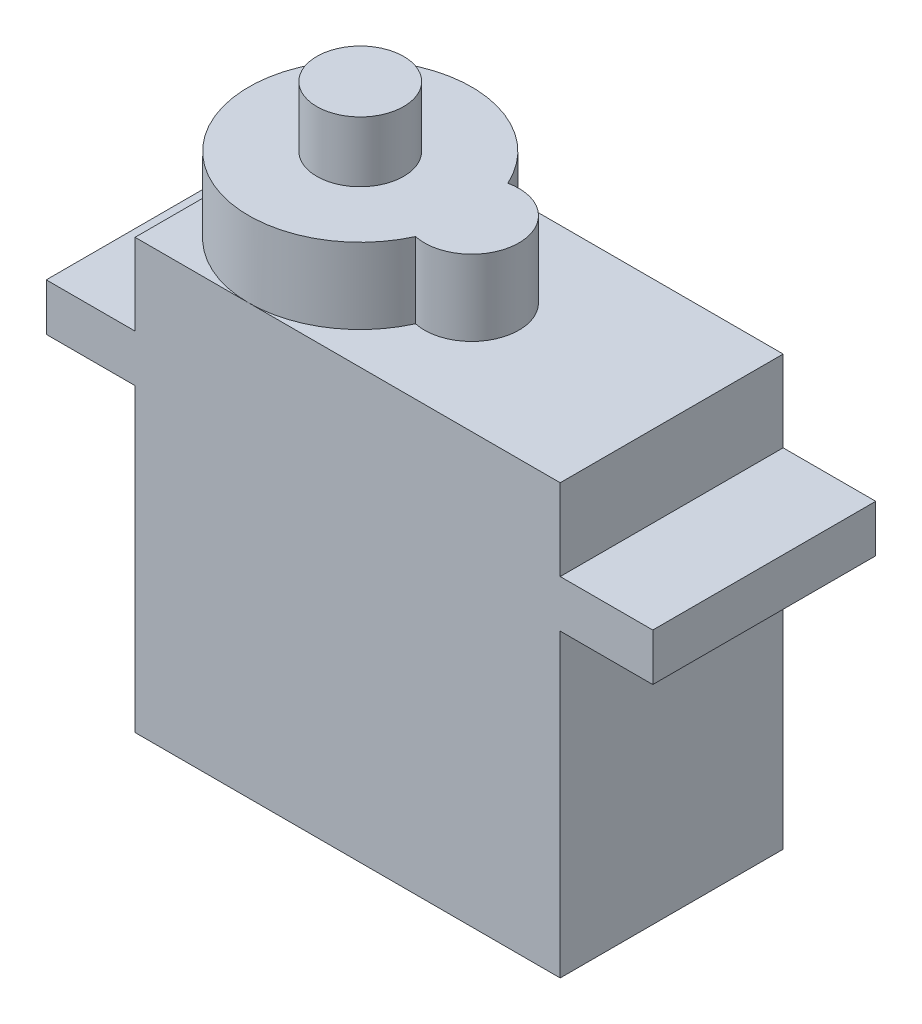
from build123d import *

# Parameters (mm, degrees)
SKETCH1_W                = 22.5
SKETCH1_H                = 11.8
BOSS_EXTRUDE1_DEPTH      = 22.7
BOSS_EXTRUDE2_DEPTH      = 4.7
BOSS_EXTRUDE2_DEPTH_BACK = 27.4
SKETCH2_W                = 11.8
SKETCH2_H                = 2.5
BOSS_EXTRUDE3_DEPTH      = 4
SKETCH4_R                = 2.3
BOSS_EXTRUDE4_DEPTH      = 3.2


with BuildPart() as part:
    # Sketch1 → Boss-Extrude1 (new body)
    with BuildSketch(Plane(origin=(0, 0, 0), x_dir=(1, 0, 0), z_dir=(0, 1, 0))):
        Rectangle(SKETCH1_W, SKETCH1_H)
    extrude(amount=BOSS_EXTRUDE1_DEPTH)

    # Sketch2 → Boss-Extrude2 (add, two sides: drawn at the far end of the back side and taken through both)
    with BuildSketch(Plane.ZY.offset(11.25).offset(-BOSS_EXTRUDE2_DEPTH_BACK)):
        with Locations((0, 17.15)):
            Rectangle(SKETCH2_W, SKETCH2_H)
    extrude(amount=BOSS_EXTRUDE2_DEPTH + BOSS_EXTRUDE2_DEPTH_BACK)

    # Sketch3 → Boss-Extrude3 (add)
    with BuildSketch(Plane(origin=(0, 22.7, 0), x_dir=(1, 0, 0), z_dir=(0, 1, 0))):
        with BuildLine():
            ThreePointArc((0.137725696, 2.443247676), (-11.132613287, 0), (0.137725696, -2.443247676))
            ThreePointArc((0.137725696, -2.443247676), (3.167386713, 0), (0.137725696, 2.443247676))
        make_face()
    extrude(amount=BOSS_EXTRUDE3_DEPTH)

    # Sketch4 → Boss-Extrude4 (add)
    with BuildSketch(Plane(origin=(0, 26.7, 0), x_dir=(1, 0, 0), z_dir=(0, 1, 0))):
        with Locations(Location((-5.232613287, 0, 0), (0, 0, 270))):
            Circle(SKETCH4_R)
    extrude(amount=BOSS_EXTRUDE4_DEPTH)


solid = part.part
